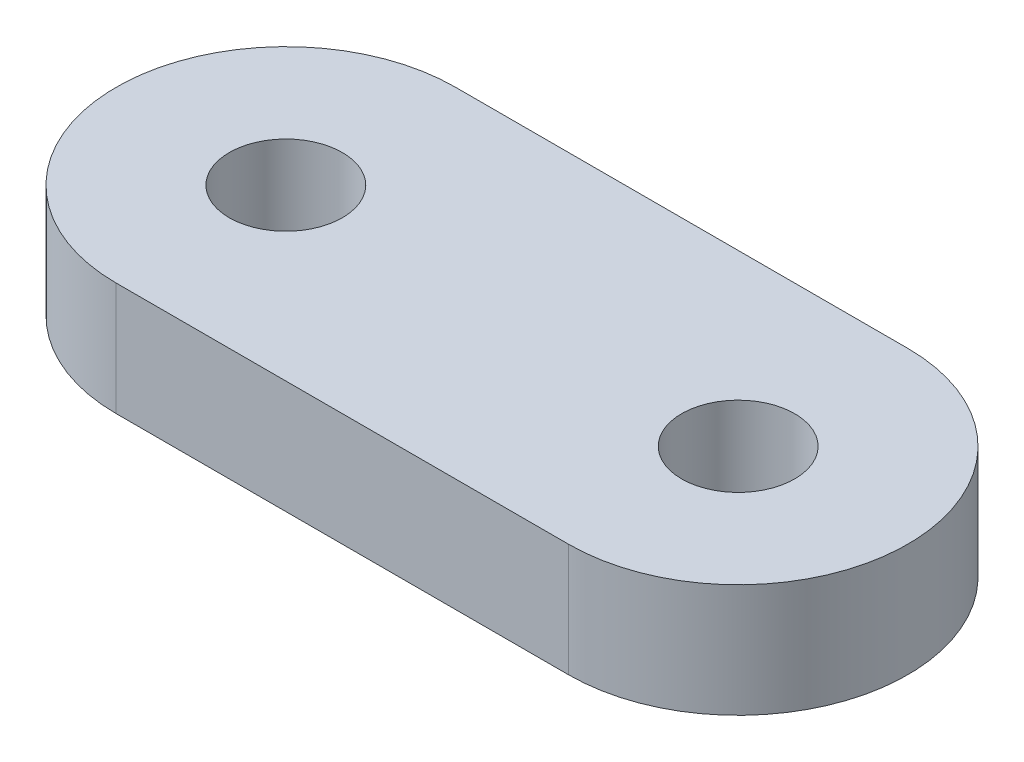
from build123d import *

# Parameters (mm, degrees)
SKETCH_1_R      = 0.5
EXTRUDE_1_DEPTH = 1


with BuildPart() as part:
    # 草图1 → 凸台-拉伸1 (new body)
    with BuildSketch(Plane(origin=(0, 0, 0), x_dir=(1, 0, 0), z_dir=(0, 1, 0))):
        with BuildLine():
            Line((0, -1.5), (-4, -1.5))
            ThreePointArc((-4, -1.5), (-5.5, 0), (-4, 1.5))
            Line((-4, 1.5), (0, 1.5))
            ThreePointArc((0, 1.5), (1.5, 0), (0, -1.5))
        make_face()
        with Locations(Location((-4, 0, 0), (0, 0, 270))):
            Circle(SKETCH_1_R, mode=Mode.SUBTRACT)
        with Locations(Location((0, 0, 0), (0, 0, 270))):
            Circle(SKETCH_1_R, mode=Mode.SUBTRACT)
    extrude(amount=EXTRUDE_1_DEPTH)


solid = part.part
